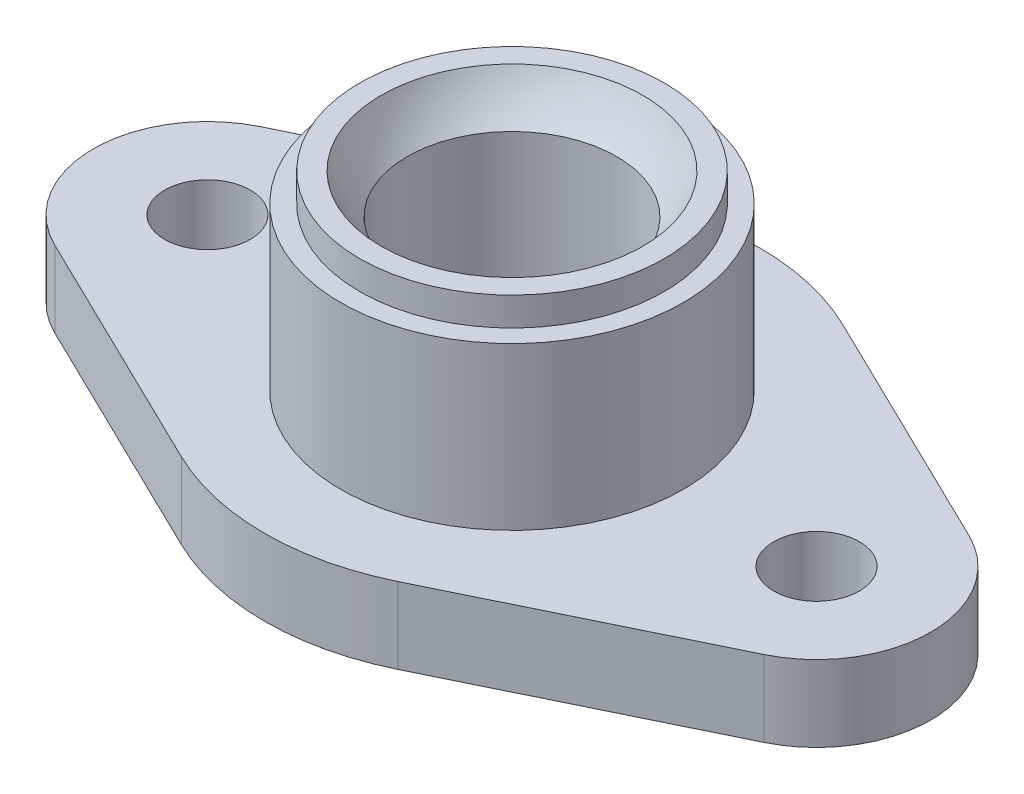
from build123d import *

# Parameters (mm, degrees)
SKETCH_1_R      = 4.5
SKETCH_1_R_2    = 11
EXTRUDE_1_DEPTH = 8
CHAMFER_1_SIZE  = 1.5


with BuildPart() as part:
    # 草图1 → 凸台-拉伸1 (new body)
    with BuildSketch(Plane(origin=(0, 0, 0), x_dir=(1, 0, 0), z_dir=(0, 1, 0))):
        with BuildLine():
            Line((-37.25, 10.790620927), (-11.375, 23.379678676))
            ThreePointArc((-11.375, 23.379678676), (0, 26), (11.375, 23.379678676))
            Line((11.375, 23.379678676), (37.25, 10.790620927))
            ThreePointArc((37.25, 10.790620927), (44, 0), (37.25, -10.790620927))
            Line((37.25, -10.790620927), (11.375, -23.379678676))
            ThreePointArc((11.375, -23.379678676), (0, -26), (-11.375, -23.379678676))
            Line((-11.375, -23.379678676), (-37.25, -10.790620927))
            ThreePointArc((-37.25, -10.790620927), (-44, 0), (-37.25, 10.790620927))
        make_face()
        with Locations(Location((-32, 0, 0), (0, 0, 270))):
            Circle(SKETCH_1_R, mode=Mode.SUBTRACT)
        with Locations(Location((32, 0, 0), (0, 0, 270))):
            Circle(SKETCH_1_R, mode=Mode.SUBTRACT)
        with Locations(Location((0, 0, 0), (0, 0, 270))):
            Circle(SKETCH_1_R_2, mode=Mode.SUBTRACT)
    extrude(amount=EXTRUDE_1_DEPTH)

    # 草图2 → 旋转1 (revolve)
    with BuildSketch(Plane(origin=(0, 0, 0), x_dir=(0, 0, -1), z_dir=(1, 0, 0))):
        with BuildLine():
            Line((-18, 8), (-11, 8))
            Line((-11, 8), (-11, 23.801960973))
            ThreePointArc((-11, 23.801960973), (-12.550632728, 25.7852804), (-13.747727085, 28))
            Line((-13.747727085, 28), (-16, 28))
            Line((-16, 28), (-16, 25))
            Line((-16, 25), (-18, 25))
            Line((-18, 25), (-18, 8))
        make_face()
    revolve(axis=Axis((0, 0, 0), (0, 1, 0)))

    # 倒角1
    chamfer_1_edges = [part.edges().sort_by_distance(p)[0] for p in [
        (0, 0, -11),
    ]]
    chamfer(chamfer_1_edges, length=CHAMFER_1_SIZE)


solid = part.part
